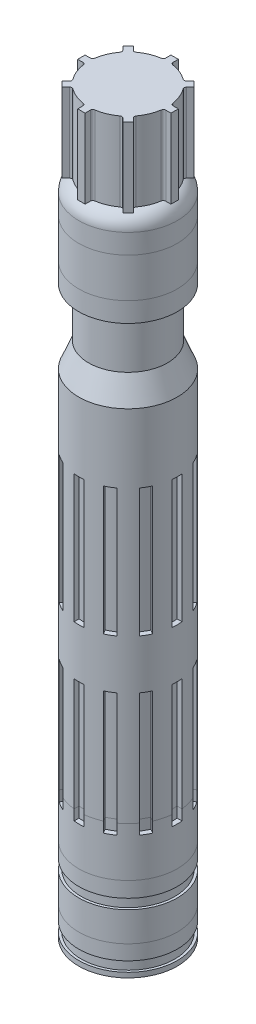
from build123d import *

# Parameters (mm, degrees)
CUT_EXTRUDE1_REACH        = 84.24
CUT_EXTRUDE1_START_RADIUS = 10
CUT_EXTRUDE1_END_RADIUS   = 10
SKETCH2_W                 = 25
SKETCH2_H                 = 2
SKETCH2_W_2               = 26
CIRPATTERN1_COUNT         = 12
SKETCH3_W                 = 2.510364456
SKETCH3_H                 = 1.5
BOSS_EXTRUDE2_DEPTH       = 16
CIRPATTERN2_COUNT         = 8
FILLET1_R                 = 0.5
FILLET2_R                 = 0.5


with BuildPart() as part:
    # Sketch1 → Revolve1 (revolve)
    with BuildSketch(Plane.YZ):
        with BuildLine():
            Line((-70, 10), (-70, 0))
            Line((-70, 0), (80, 0))
            Line((80, 0), (80, 8))
            Line((80, 8), (64, 8))
            ThreePointArc((64, 8), (62.802775638, 9.454163457), (61, 10))
            Line((61, 10), (45, 10))
            Line((45, 10), (45, 8))
            Line((45, 8), (35, 8))
            Line((35, 8), (30, 10))
            Line((30, 10), (-56, 10))
            Line((-56, 10), (-56, 9.5))
            Line((-56, 9.5), (-58, 9.5))
            Line((-58, 9.5), (-58, 10))
            Line((-58, 10), (-67, 10))
            Line((-67, 10), (-67, 9.5))
            Line((-67, 9.5), (-69, 9.5))
            Line((-69, 9.5), (-69, 10))
            Line((-69, 10), (-70, 10))
        make_face()
    revolve(axis=Axis((0, -96.079905923, 0), (0, 1, 0)))

    # Cut-Extrude1: from a cylinder face, 84.24 long prism both ways, kept between that surface and its translate by the depth
    cut_extrude1_start = Plane(origin=(0, -14.75, 0), z_dir=(0, -1, 0)) * Cylinder(CUT_EXTRUDE1_START_RADIUS, 224.98, mode=Mode.PRIVATE)
    cut_extrude1_end = Plane(origin=(-1, -14.75, 0), z_dir=(0, -1, 0)) * Cylinder(CUT_EXTRUDE1_END_RADIUS, 224.98, mode=Mode.PRIVATE)
    # Sketch2 → Cut-Extrude1 (cut, from a surface)
    with BuildSketch(Plane.YZ, mode=Mode.PRIVATE) as cut_extrude1_sk1:
        with Locations((-32.5, 0)):
            Rectangle(SKETCH2_W, SKETCH2_H)
    cut_extrude1_tool1 = extrude(cut_extrude1_sk1.sketch, amount=CUT_EXTRUDE1_REACH, both=True, mode=Mode.PRIVATE)
    # Sketch2 → Cut-Extrude1 (cut, from a surface)
    with BuildSketch(Plane.YZ, mode=Mode.PRIVATE) as cut_extrude1_sk2:
        with Locations((3, 0)):
            Rectangle(SKETCH2_W_2, SKETCH2_H)
    cut_extrude1_tool2 = extrude(cut_extrude1_sk2.sketch, amount=CUT_EXTRUDE1_REACH, both=True, mode=Mode.PRIVATE)
    cut_extrude1 = ((cut_extrude1_tool1 & cut_extrude1_start) - cut_extrude1_end).solids().sort_by_distance((0, 30, -10))[0] + ((cut_extrude1_tool2 & cut_extrude1_start) - cut_extrude1_end).solids().sort_by_distance((0, 30, -10))[0]
    add(cut_extrude1, mode=Mode.SUBTRACT)

    # CirPattern1: Cut-Extrude1 ×12 about axis
    cirpattern1_axis = Axis((0, 30, 0), (0, -1, 0))
    for i in range(1, CIRPATTERN1_COUNT):
        add(cut_extrude1.rotate(cirpattern1_axis, i * 360 / CIRPATTERN1_COUNT), mode=Mode.SUBTRACT)

    # Sketch3 → Boss-Extrude2 (add)
    with BuildSketch(Plane(origin=(0, 80, 0), x_dir=(-1, 0, 0), z_dir=(0, 1, 0))):
        with Locations((8.204817772, 0)):
            Rectangle(SKETCH3_W, SKETCH3_H)
    boss_extrude2 = extrude(amount=-BOSS_EXTRUDE2_DEPTH)

    # CirPattern2: Boss-Extrude2 ×8 about axis
    cirpattern2_axis = Axis((0, 80, 0), (0, -1, 0))
    for i in range(1, CIRPATTERN2_COUNT):
        add(boss_extrude2.rotate(cirpattern2_axis, i * 360 / CIRPATTERN2_COUNT))

    # Fillet1
    fillet1_edges = [part.edges().sort_by_distance(p)[0] for p in [
        (-7.964766161, 72, 0.75),
        (-7.964766161, 72, -0.75),
    ]]
    fillet(fillet1_edges, radius=FILLET1_R)

    # Fillet2
    fillet2_edges = [part.edges().sort_by_distance(p)[0] for p in [
        (-5.101610077, 72, -6.162270249),
        (-6.162270249, 72, -5.101610077),
        (-6.162270249, 72, 5.101610077),
        (-5.101610077, 72, 6.162270249),
        (-0.75, 72, 7.964766161),
        (0.75, 72, 7.964766161),
        (5.101610077, 72, 6.162270249),
        (6.162270249, 72, 5.101610077),
        (7.964766161, 72, 0.75),
        (7.964766161, 72, -0.75),
        (6.162270249, 72, -5.101610077),
        (5.101610077, 72, -6.162270249),
        (0.75, 72, -7.964766161),
        (-0.75, 72, -7.964766161),
    ]]
    fillet(fillet2_edges, radius=FILLET2_R)


solid = part.part
